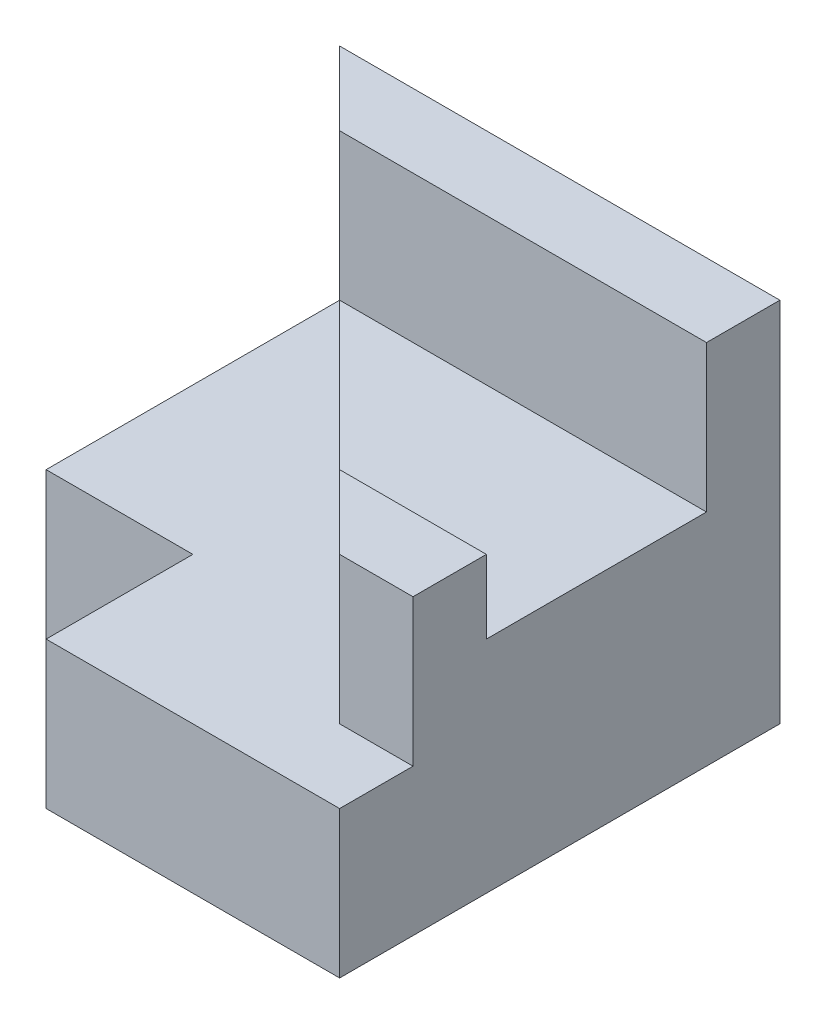
from build123d import *

# Parameters (mm, degrees)
BOSS_EXTRUDE1_DEPTH = 120
SKETCH1_3_W         = 80
SKETCH1_3_H         = 80
BOSS_EXTRUDE2_DEPTH = 40
BOSS_EXTRUDE3_DEPTH = 120
SKETCH1_5_W         = 80
SKETCH1_5_H         = 80
BOSS_EXTRUDE4_DEPTH = 120
BOSS_EXTRUDE7_DEPTH = 80
BOSS_EXTRUDE8_DEPTH = 120
BOSS_EXTRUDE9_DEPTH = 40


with BuildPart() as part:
    # Sketch1 → Boss-Extrude1 (new body)
    with BuildSketch(Plane.XY):
        Polygon((120, -100), (120, -20), (80, -20), (-40, -20), (-40, -100), align=None)
    extrude(amount=BOSS_EXTRUDE1_DEPTH)

    # Sketch1<3> → Boss-Extrude2 (add)
    with BuildSketch(Plane.XY):
        with Locations((-80, -60)):
            Rectangle(SKETCH1_3_W, SKETCH1_3_H)
    extrude(amount=BOSS_EXTRUDE2_DEPTH)

    # Sketch1<4> → Boss-Extrude3 (add)
    with BuildSketch(Plane.XY):
        Polygon((120, -100), (120, -20), (80, -20), (-40, -20), (-40, -100), align=None)
    extrude(amount=-BOSS_EXTRUDE3_DEPTH)

    # Sketch1<5> → Boss-Extrude4 (add)
    with BuildSketch(Plane.XY):
        with Locations((-80, -60)):
            Rectangle(SKETCH1_5_W, SKETCH1_5_H)
    extrude(amount=-BOSS_EXTRUDE4_DEPTH)

    # Sketch4 → Boss-Extrude7 (add)
    with BuildSketch(Plane(origin=(0, -20, 0), x_dir=(1, 0, 0), z_dir=(0, 1, 0))):
        Polygon((80, -80), (120, -80), (120, -40), (40, -40), align=None)
    extrude(amount=BOSS_EXTRUDE7_DEPTH)

    # Sketch4<3> → Boss-Extrude8 (add)
    with BuildSketch(Plane(origin=(0, -20, 0), x_dir=(1, 0, 0), z_dir=(0, 1, 0))):
        Polygon((-80, 80), (120, 80), (120, 120), (-120, 120), align=None)
    extrude(amount=BOSS_EXTRUDE8_DEPTH)

    # Sketch4<4> → Boss-Extrude9 (add)
    with BuildSketch(Plane(origin=(0, -20, 0), x_dir=(1, 0, 0), z_dir=(0, 1, 0))):
        Polygon((40, -40), (120, -40), (120, 80), (-80, 80), align=None)
    extrude(amount=BOSS_EXTRUDE9_DEPTH)


solid = part.part
